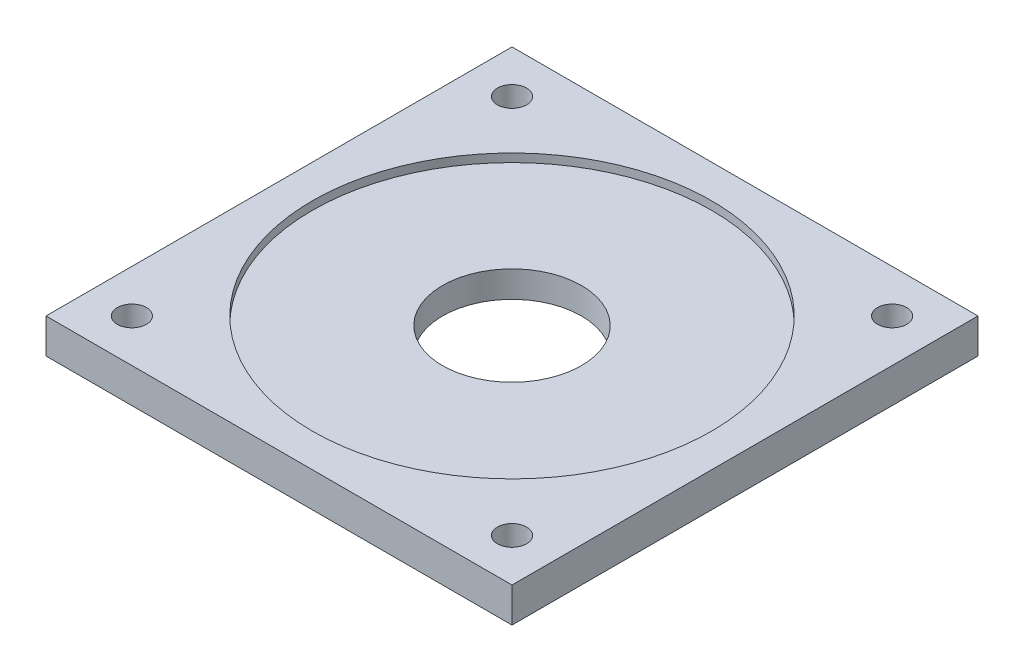
from build123d import *

# Parameters (mm, degrees)
SKETCH1_W           = 85.2
SKETCH1_H           = 85.2
BOSS_EXTRUDE1_DEPTH = 6.35
CUT_EXTRUDE1_REACH  = 62.579
SKETCH2_R           = 36.49
BOSS_EXTRUDE2_START = -4.83
SKETCH5_R           = 36.49
SKETCH5_R_2         = 12.7
BOSS_EXTRUDE2_DEPTH = 4.83
CUT_EXTRUDE2_REACH  = 62.579
SKETCH6_R           = 2.665


with BuildPart() as part:
    # Sketch1 → Boss-Extrude1 (new body)
    with BuildSketch(Plane(origin=(0, 0, 0), x_dir=(1, 0, 0), z_dir=(0, 1, 0))):
        Rectangle(SKETCH1_W, SKETCH1_H)
    extrude(amount=BOSS_EXTRUDE1_DEPTH)

    # Sketch2 → Cut-Extrude1 (cut, up to next)
    with BuildSketch(Plane(origin=(0, 6.35, 0), x_dir=(1, 0, 0), z_dir=(0, 1, 0)), mode=Mode.PRIVATE) as cut_extrude1_sk1:
        with Locations(Location((0, 0, 0), (0, 0, 270))):
            Circle(SKETCH2_R)
    cut_extrude1_tool1 = extrude(cut_extrude1_sk1.sketch, amount=-CUT_EXTRUDE1_REACH, mode=Mode.PRIVATE) & part.part
    add(cut_extrude1_tool1.solids().sort_by_distance((0, 6.35, 0))[0], mode=Mode.SUBTRACT)

    # Sketch5 → Boss-Extrude2 (add)
    with BuildSketch(Plane.XZ.offset(BOSS_EXTRUDE2_START)):
        with Locations(Location((0, 0, 0), (0, 0, 90))):
            Circle(SKETCH5_R)
        with Locations(Location((0, 0, 0), (0, 0, 270))):
            Circle(SKETCH5_R_2, mode=Mode.SUBTRACT)
    extrude(amount=BOSS_EXTRUDE2_DEPTH)

    # Sketch6 → Cut-Extrude2 (cut, up to next)
    with BuildSketch(Plane.XZ, mode=Mode.PRIVATE) as cut_extrude2_sk1:
        with Locations(Location((-34.75, -34.75, 0), (0, 0, 270))):
            Circle(SKETCH6_R)
    cut_extrude2_tool1 = extrude(cut_extrude2_sk1.sketch, amount=-CUT_EXTRUDE2_REACH, mode=Mode.PRIVATE) & part.part
    # Sketch6 → Cut-Extrude2 (cut, up to next)
    with BuildSketch(Plane.XZ, mode=Mode.PRIVATE) as cut_extrude2_sk2:
        with Locations(Location((-34.75, 34.75, 0), (0, 0, 270))):
            Circle(SKETCH6_R)
    cut_extrude2_tool2 = extrude(cut_extrude2_sk2.sketch, amount=-CUT_EXTRUDE2_REACH, mode=Mode.PRIVATE) & part.part
    # Sketch6 → Cut-Extrude2 (cut, up to next)
    with BuildSketch(Plane.XZ, mode=Mode.PRIVATE) as cut_extrude2_sk3:
        with Locations(Location((34.75, 34.75, 0), (0, 0, 270))):
            Circle(SKETCH6_R)
    cut_extrude2_tool3 = extrude(cut_extrude2_sk3.sketch, amount=-CUT_EXTRUDE2_REACH, mode=Mode.PRIVATE) & part.part
    # Sketch6 → Cut-Extrude2 (cut, up to next)
    with BuildSketch(Plane.XZ, mode=Mode.PRIVATE) as cut_extrude2_sk4:
        with Locations(Location((34.75, -34.75, 0), (0, 0, 270))):
            Circle(SKETCH6_R)
    cut_extrude2_tool4 = extrude(cut_extrude2_sk4.sketch, amount=-CUT_EXTRUDE2_REACH, mode=Mode.PRIVATE) & part.part
    add(cut_extrude2_tool1.solids().sort_by_distance((-34.75, 0, -34.75))[0], mode=Mode.SUBTRACT)
    add(cut_extrude2_tool2.solids().sort_by_distance((-34.75, 0, 34.75))[0], mode=Mode.SUBTRACT)
    add(cut_extrude2_tool3.solids().sort_by_distance((34.75, 0, 34.75))[0], mode=Mode.SUBTRACT)
    add(cut_extrude2_tool4.solids().sort_by_distance((34.75, 0, -34.75))[0], mode=Mode.SUBTRACT)


solid = part.part
